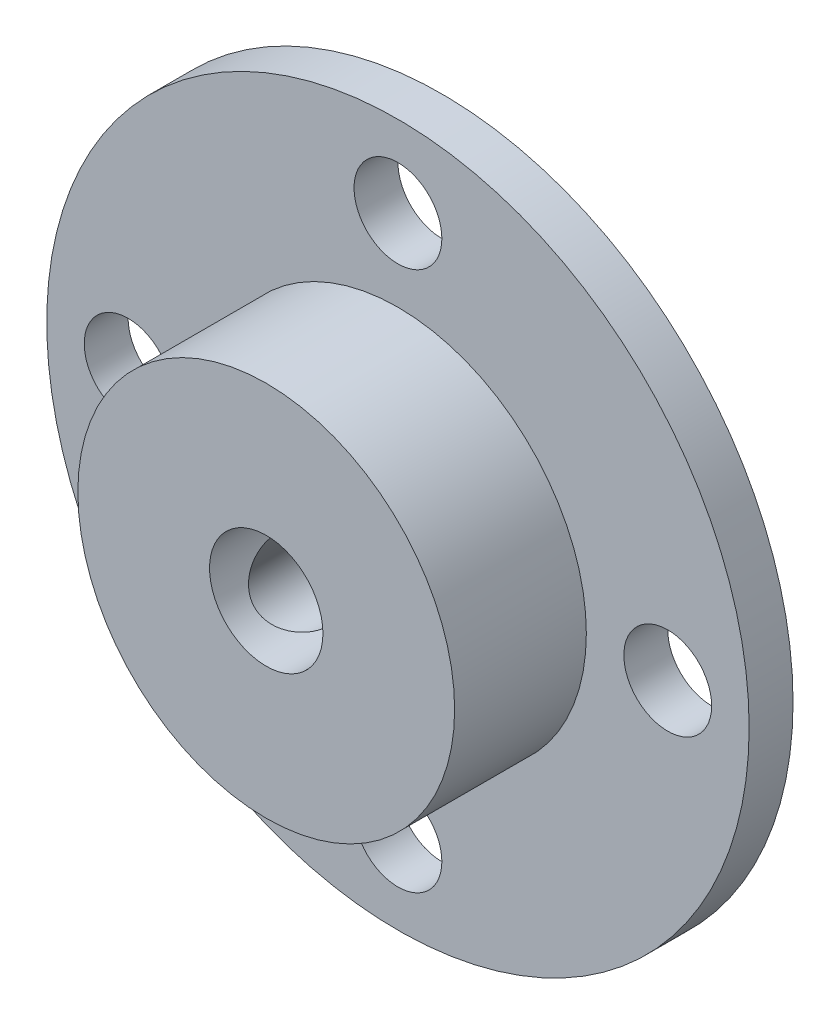
from build123d import *

# Parameters (mm, degrees)
F_1_8_0_125_DIAMETER_HOLE1_D = 3.175
F_6_32_TAPPED_HOLE1_D        = 2.7051
F_6_32_TAPPED_HOLE1_DEPTH    = 6.858
F_6_32_TAPPED_HOLE1_TIP      = 0.81269403


with BuildPart() as part:
    # Sketch1 → Revolve1 (revolve)
    with BuildSketch(Plane(origin=(15.304322218, 0, 0), x_dir=(0, 0, -1), z_dir=(1, 0, 0)), mode=Mode.PRIVATE) as revolve1_sk:
        Polygon((-7.493, 22.653467802), (-7.493, 12.003467802), (-9.0805, 12.003467802), (-9.0805, 17.890967802), (-13.843, 17.890967802), (-13.843, 22.653467802), align=None)
    revolve(revolve1_sk.sketch.rotate(Axis((15.304322218, 24.703467802, 13.843), (0, 0, -1)), 270), axis=Axis((15.304322218, 24.703467802, 13.843), (0, 0, -1)))

    # 1/8 (0.125) Diameter Hole1 (through all)
    with Locations(Plane.XY.offset(9.0805)):
        with Locations((15.304322218, 14.947217802), (25.060572218, 24.703467802), (15.304322218, 34.459717802), (5.548072218, 24.703467802)):
            Hole(F_1_8_0_125_DIAMETER_HOLE1_D / 2)

    # #6-32 Tapped Hole1
    with Locations(Plane(origin=(15.186730063, 15.186730063, 0), x_dir=(0, 0, 1), z_dir=(-0.7071067811865488, -0.7071067811865464, 0))):
        with Locations((11.46175, 6.646199579)):
            Hole(F_6_32_TAPPED_HOLE1_D / 2, depth=F_6_32_TAPPED_HOLE1_DEPTH)
            with Locations((0, 0, -(F_6_32_TAPPED_HOLE1_DEPTH + F_6_32_TAPPED_HOLE1_TIP / 2))):  # 118° drill point
                Cone(0, F_6_32_TAPPED_HOLE1_D / 2, F_6_32_TAPPED_HOLE1_TIP, mode=Mode.SUBTRACT)


solid = part.part
